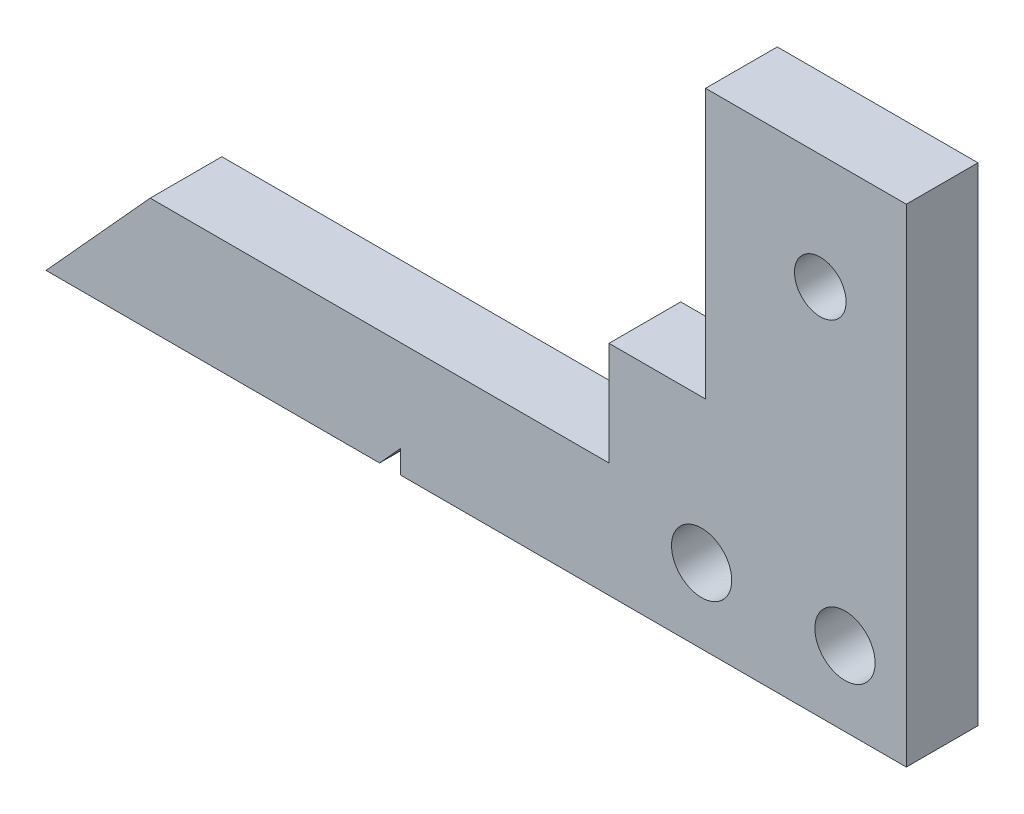
from build123d import *

# Parameters (mm, degrees)
SKETCH1_R           = 1.3335
SKETCH1_R_2         = 1.143
BOSS_EXTRUDE1_DEPTH = 3.175


with BuildPart() as part:
    # Sketch1 → Boss-Extrude1 (new body)
    with BuildSketch(Plane.XY):
        Polygon((0, 0), (4.613655526, 5.08), (24.933655526, 5.08), (24.933655526, 9.671782949), (29.21, 9.671782949), (29.21, 21.59), (38.1, 21.59), (38.1, 0), (15.700557681, 0), (15.700557681, 1.020592656), (14.773655526, 0), align=None)
        with Locations((29.033993158, 3.299509856)):
            Circle(SKETCH1_R, mode=Mode.SUBTRACT)
        with Locations((35.383993158, 3.299509856)):
            Circle(SKETCH1_R, mode=Mode.SUBTRACT)
        with Locations((34.29, 16.51)):
            Circle(SKETCH1_R_2, mode=Mode.SUBTRACT)
    extrude(amount=BOSS_EXTRUDE1_DEPTH)


solid = part.part
